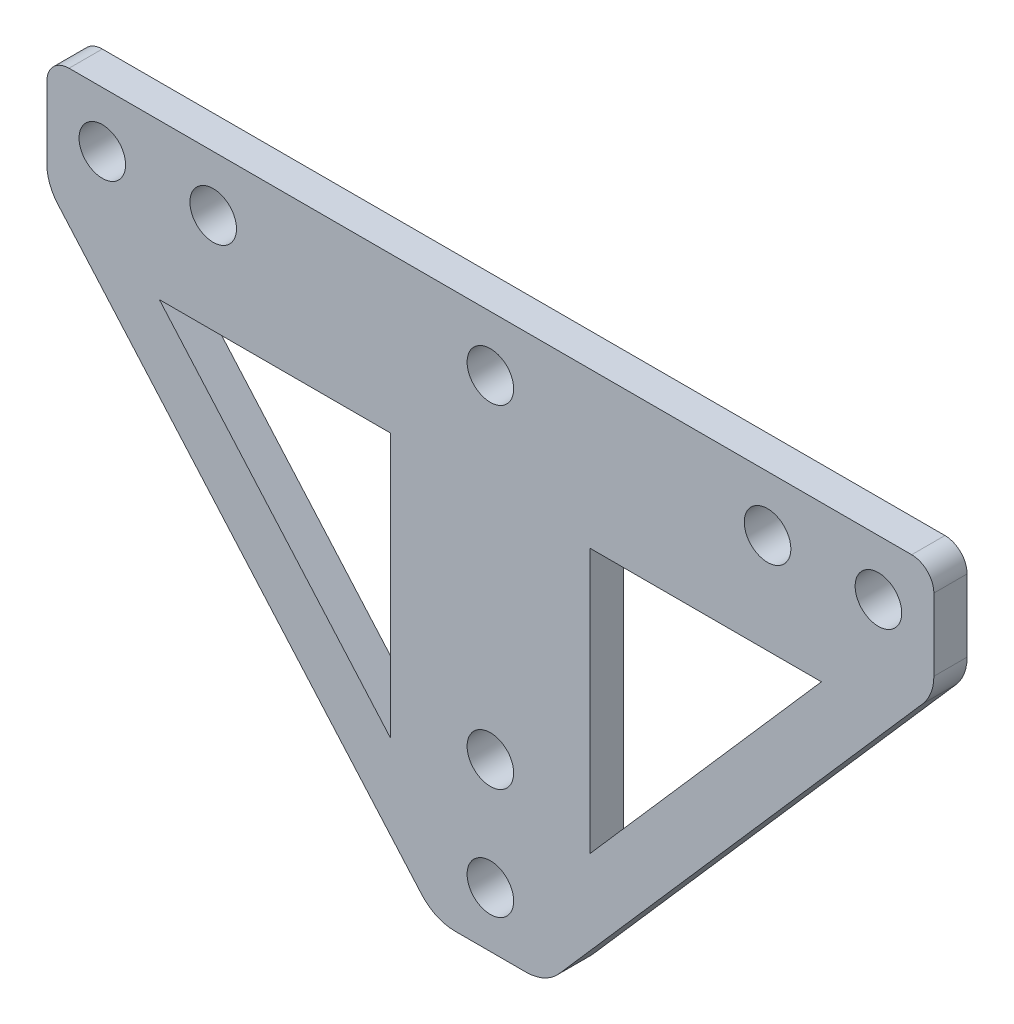
from build123d import *

# Parameters (mm, degrees)
EXTRUDE_1_DEPTH     = 3
SKETCH_2_R          = 2.1
CUT_EXTRUDE_1_DEPTH = 95.387499172
CUT_EXTRUDE_2_DEPTH = 95.387499172
FILLET_1_R          = 2
FILLET_2_R          = 4


with BuildPart() as part:
    # 草图1 → 凸台-拉伸1 (new body)
    with BuildSketch(Plane.XY):
        Polygon((0, 0), (80, 0), (80, -10), (45, -50), (35, -50), (0, -10), align=None)
    extrude(amount=EXTRUDE_1_DEPTH)

    # 草图2 → 切除-拉伸1 (cut, through all)
    with BuildSketch(Plane.XY.offset(3)):
        with Locations((5, -5)):
            Circle(SKETCH_2_R)
        with Locations((15, -5)):
            Circle(SKETCH_2_R)
        with Locations(Location((65, -5, 0), (0, 0, 180))):
            Circle(SKETCH_2_R)
        with Locations(Location((75, -5, 0), (0, 0, 180))):
            Circle(SKETCH_2_R)
        with Locations((40, -45)):
            Circle(SKETCH_2_R)
        with Locations((40, -35)):
            Circle(SKETCH_2_R)
        with Locations((40, -5)):
            Circle(SKETCH_2_R)
    extrude(amount=-CUT_EXTRUDE_1_DEPTH, mode=Mode.SUBTRACT)

    # 草图3 → 切除-拉伸2 (cut, through all)
    with BuildSketch(Plane.XY.offset(3)):
        Polygon((10.143841133, -14), (31, -14), (31, -37.835610134), align=None)
        Polygon((49, -37.835610134), (69.856158867, -14), (49, -14), align=None)
    extrude(amount=-CUT_EXTRUDE_2_DEPTH, mode=Mode.SUBTRACT)

    # 圆角1
    fillet_1_edges = [part.edges().sort_by_distance(p)[0] for p in [
        (0, 0, 1.5),
        (80, 0, 1.5),
    ]]
    fillet(fillet_1_edges, radius=FILLET_1_R)

    # 圆角2
    fillet_2_edges = [part.edges().sort_by_distance(p)[0] for p in [
        (80, -10, 1.5),
        (45, -50, 1.5),
        (35, -50, 1.5),
        (0, -10, 1.5),
    ]]
    fillet(fillet_2_edges, radius=FILLET_2_R)


solid = part.part
